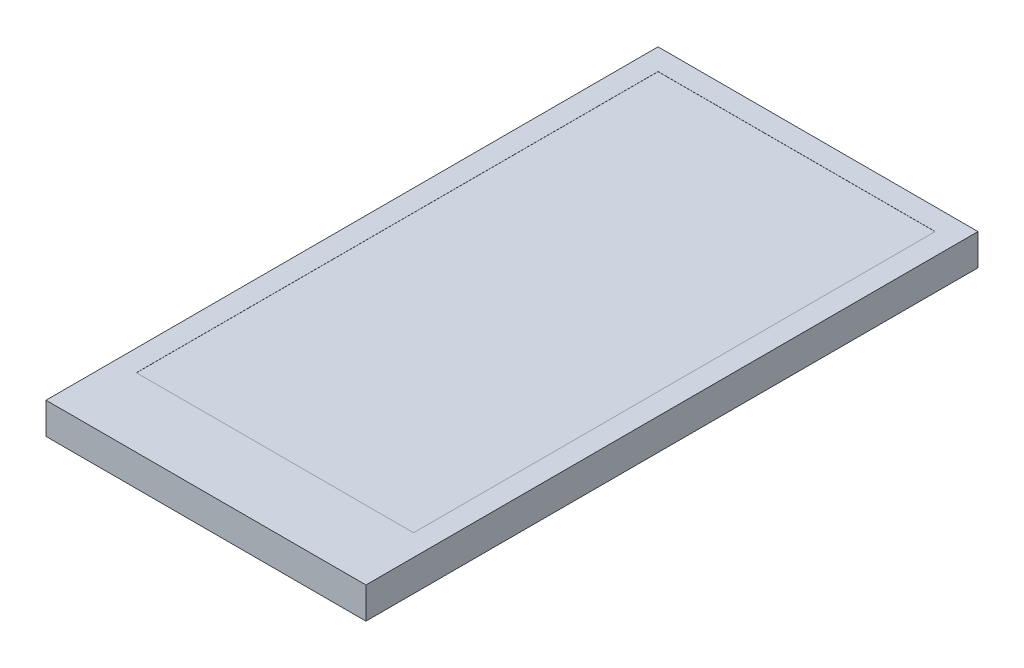
from build123d import *

# Parameters (mm, degrees)
SKETCH_1_W          = 26.2
SKETCH_1_H          = 50.12
EXTRUDE_1_DEPTH     = 2.57
SKETCH_2_W          = 22.7
SKETCH_2_H          = 42.72
CUT_EXTRUDE_1_DEPTH = 0.01


with BuildPart() as part:
    # 草图1 → 凸台-拉伸1 (new body)
    with BuildSketch(Plane(origin=(0, 0, 0), x_dir=(1, 0, 0), z_dir=(0, 1, 0))):
        with Locations((62.174155813, -25.06)):
            Rectangle(SKETCH_1_W, SKETCH_1_H)
    extrude(amount=EXTRUDE_1_DEPTH)

    # 草图2 → 切除-拉伸1 (cut)
    with BuildSketch(Plane(origin=(0, 2.57, 0), x_dir=(1, 0, 0), z_dir=(0, 1, 0))):
        with Locations((62.174155813, -23.11)):
            Rectangle(SKETCH_2_W, SKETCH_2_H)
    extrude(amount=-CUT_EXTRUDE_1_DEPTH, mode=Mode.SUBTRACT)


solid = part.part
